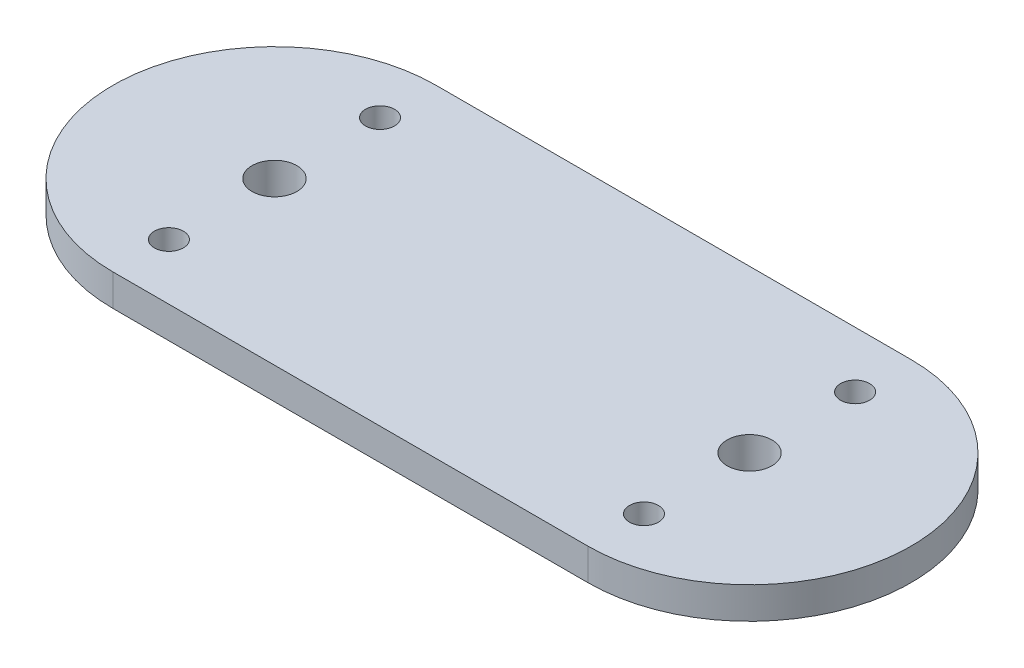
from build123d import *

# Parameters (mm, degrees)
BOSS_EXTRUDE1_DEPTH = 3
SKETCH2_R           = 2.125
SKETCH2_R_2         = 1.375
CUT_EXTRUDE1_DEPTH  = 57.401986652


with BuildPart() as part:
    # Sketch1 → Boss-Extrude1 (new body)
    with BuildSketch(Plane(origin=(0, 0, 0), x_dir=(1, 0, 0), z_dir=(0, 1, 0))):
        with BuildLine():
            Line((-31.972318339, 0), (13.027681661, 0))
            ThreePointArc((13.027681661, 0), (28.332991201, -15.30530954), (13.027681661, -30.61061908))
            Line((13.027681661, -30.61061908), (-31.972318339, -30.61061908))
            ThreePointArc((-31.972318339, -30.61061908), (-47.277627879, -15.30530954), (-31.972318339, 0))
        make_face()
    extrude(amount=BOSS_EXTRUDE1_DEPTH)

    # Sketch2 → Cut-Extrude1 (cut, through all)
    with BuildSketch(Plane(origin=(0, 3, 0), x_dir=(1, 0, 0), z_dir=(0, 1, 0))):
        with Locations(Location((-31.972318339, -15.30530954, 0), (0, 0, 270))):
            Circle(SKETCH2_R)
        with Locations(Location((-31.972318339, -5.30530954, 0), (0, 0, 270))):
            Circle(SKETCH2_R_2)
        with Locations(Location((-31.972318339, -25.30530954, 0), (0, 0, 90))):
            Circle(SKETCH2_R_2)
        with Locations(Location((13.027681661, -5.30530954, 0), (0, 0, 90))):
            Circle(SKETCH2_R_2)
        with Locations(Location((13.027681661, -15.30530954, 0), (0, 0, 90))):
            Circle(SKETCH2_R)
        with Locations(Location((13.027681661, -25.30530954, 0), (0, 0, 270))):
            Circle(SKETCH2_R_2)
    extrude(amount=-CUT_EXTRUDE1_DEPTH, mode=Mode.SUBTRACT)


solid = part.part
